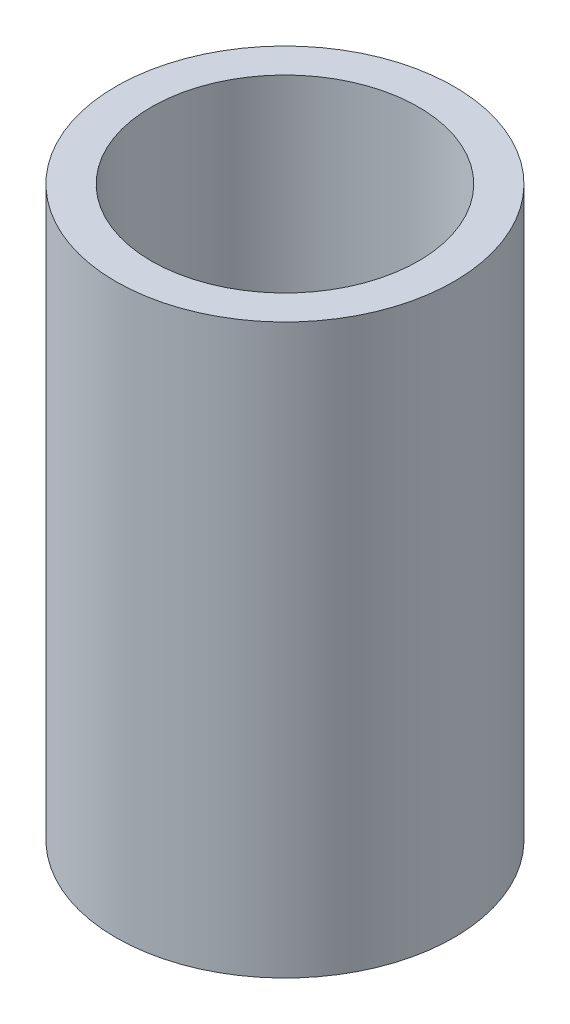
from build123d import *

# Parameters (mm, degrees)
SKETCH1_R           = 3.0226
SKETCH1_R_2         = 2.3876
BOSS_EXTRUDE1_DEPTH = 10.16


with BuildPart() as part:
    # Sketch1 → Boss-Extrude1 (new body)
    with BuildSketch(Plane(origin=(0, 0, 0), x_dir=(1, 0, 0), z_dir=(0, 1, 0))):
        with Locations(Location((0, 0, 0), (0, 0, 270))):
            Circle(SKETCH1_R)
        with Locations(Location((0, 0, 0), (0, 0, 270))):
            Circle(SKETCH1_R_2, mode=Mode.SUBTRACT)
    extrude(amount=BOSS_EXTRUDE1_DEPTH)


solid = part.part
